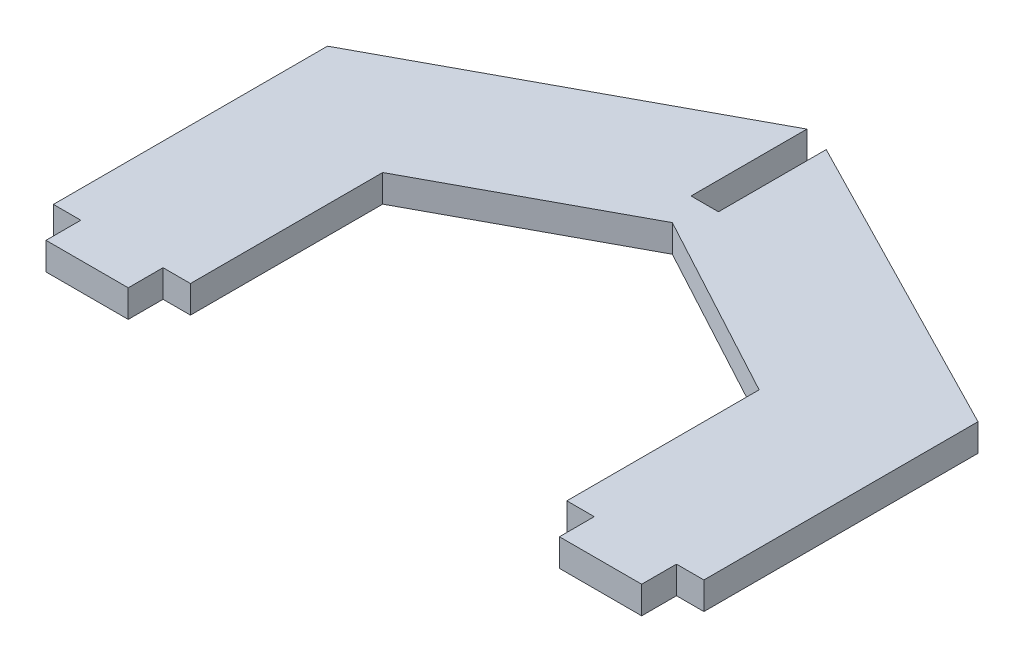
from build123d import *

# Parameters (mm, degrees)
BOSS_EXTRUDE1_DEPTH = 5


with BuildPart() as part:
    # Sketch1 → Boss-Extrude1 (new body)
    with BuildSketch(Plane(origin=(0, 0, 0), x_dir=(1, 0, 0), z_dir=(0, 1, 0))):
        Polygon((-72.763800855, -36.482591992), (-67.763800855, -36.482591992), (-67.763800855, -42.832591992), (-52.763800855, -42.832591992), (-52.763800855, -36.482591992), (-47.763800855, -36.482591992), (-47.763800855, -1.40972798), (-13.434360787, 17.088978271), (20.89507928, -1.40972798), (20.89507928, -36.482591992), (25.89507928, -36.482591992), (25.89507928, -42.832591992), (40.89507928, -42.832591992), (40.89507928, -36.482591992), (45.89507928, -36.482591992), (45.89507928, 13.517408008), (-10.934360787, 42.661627557), (-10.934360787, 23.003270856), (-15.934360787, 23.003270856), (-15.934360787, 44.14042767), (-72.763800855, 13.517408008), align=None)
    extrude(amount=BOSS_EXTRUDE1_DEPTH)


solid = part.part
